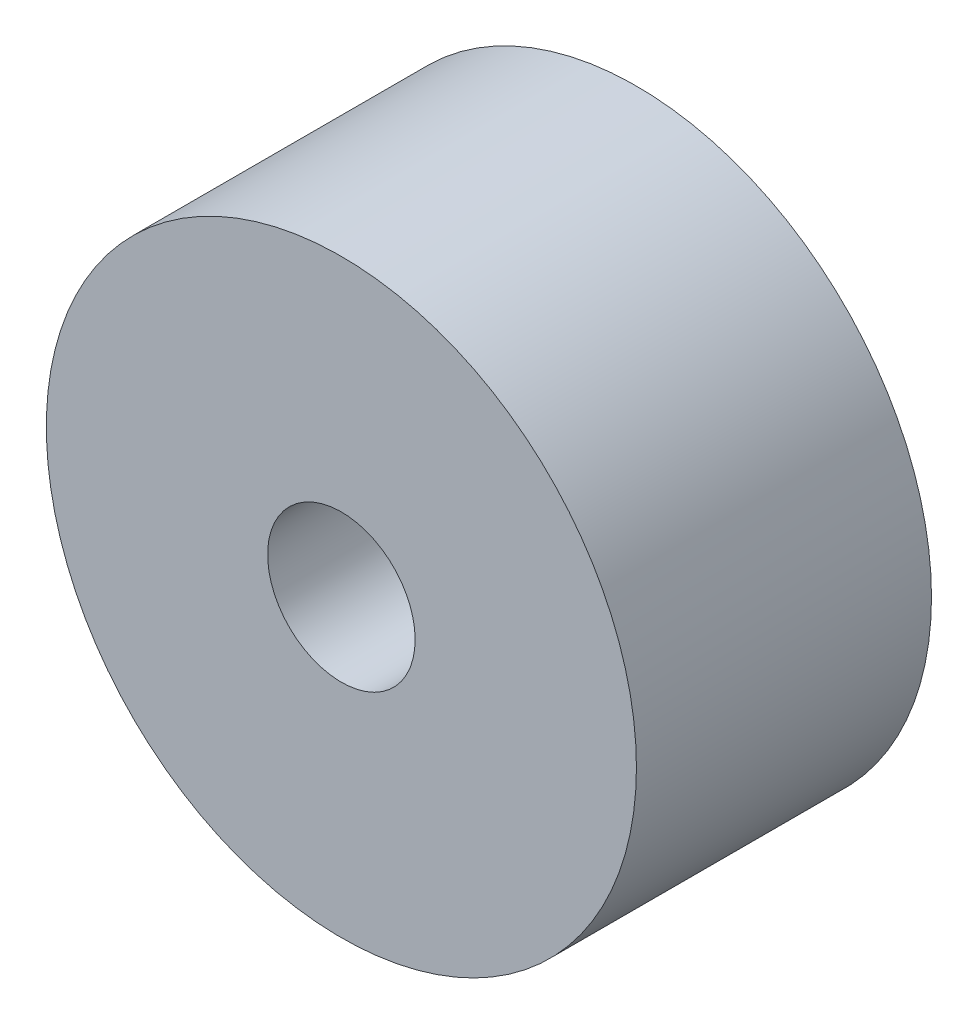
from build123d import *

# Parameters (mm, degrees)
SKETCH1_R           = 10
SKETCH1_R_2         = 2.5
BOSS_EXTRUDE1_DEPTH = 10


with BuildPart() as part:
    # Sketch1 → Boss-Extrude1 (new body)
    with BuildSketch(Plane.XY):
        Circle(SKETCH1_R)
        Circle(SKETCH1_R_2, mode=Mode.SUBTRACT)
    extrude(amount=BOSS_EXTRUDE1_DEPTH)


solid = part.part
